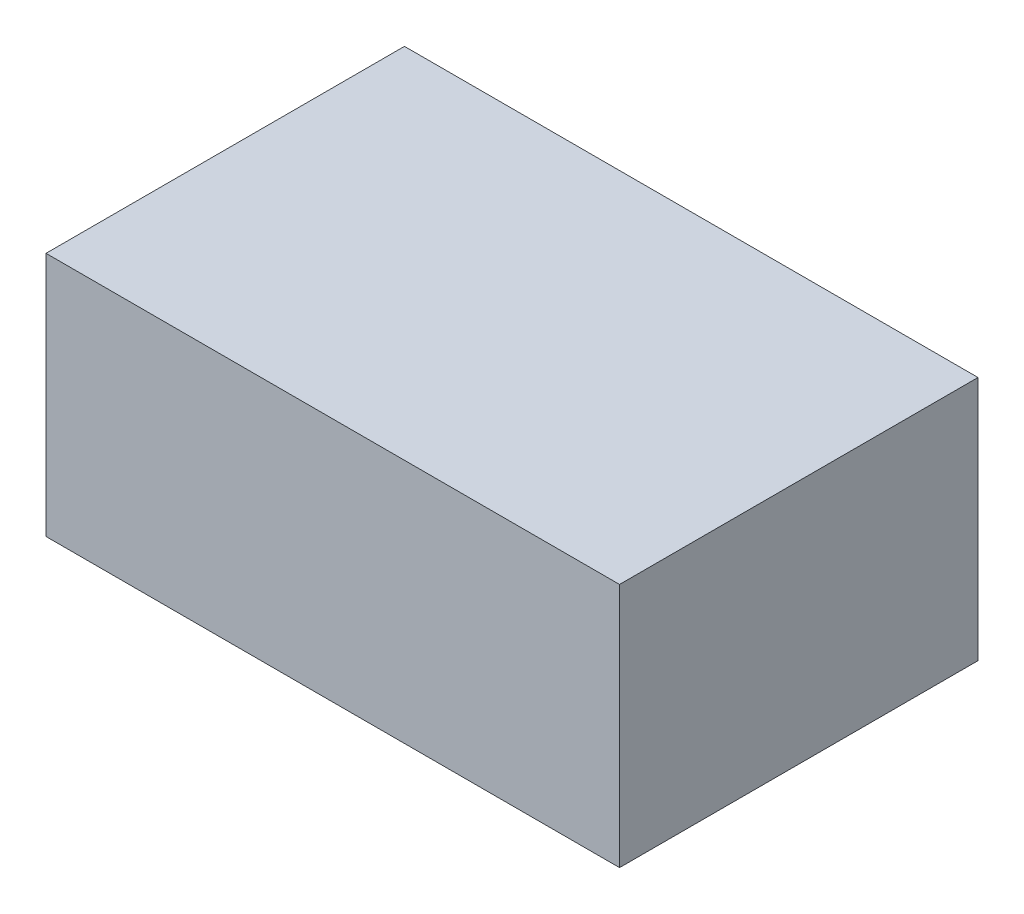
from build123d import *

# Parameters (mm, degrees)
SKETCH_1_W      = 152
SKETCH_1_H      = 65
EXTRUDE_1_DEPTH = 95


with BuildPart() as part:
    # 草图1 → 凸台-拉伸1 (new body)
    with BuildSketch(Plane.XY):
        Rectangle(SKETCH_1_W, SKETCH_1_H)
    extrude(amount=EXTRUDE_1_DEPTH)


solid = part.part
